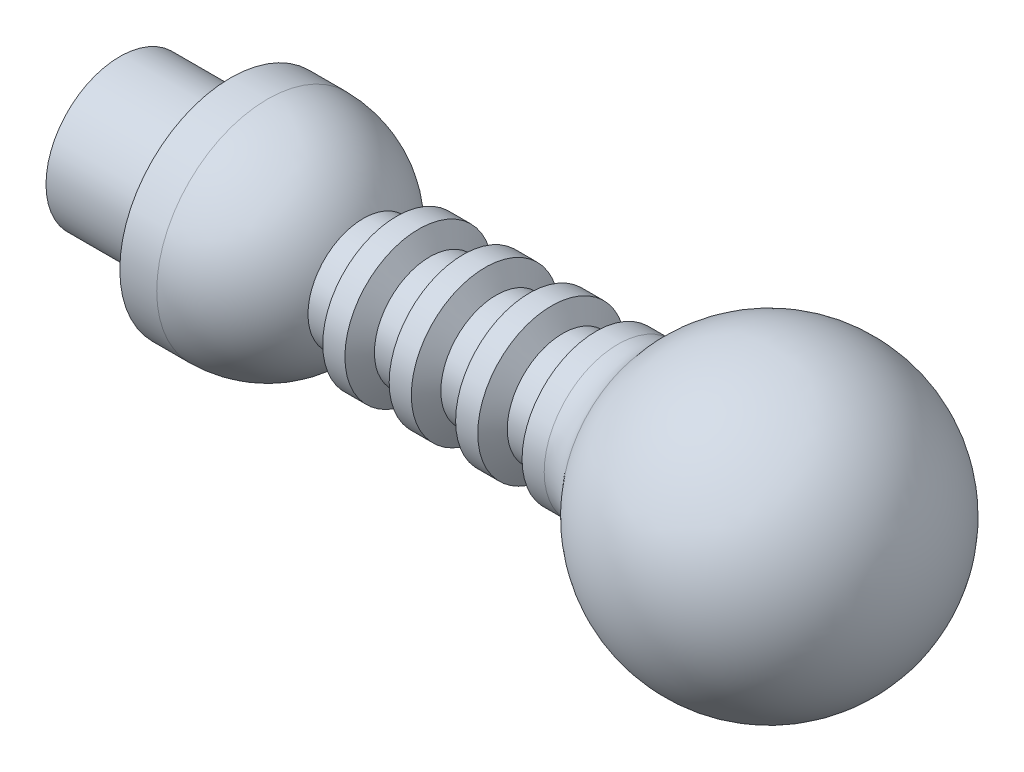
from build123d import *


with BuildPart() as part:
    # Sketch1 → Revolve1 (revolve)
    with BuildSketch(Plane.XY, mode=Mode.PRIVATE) as revolve1_sk:
        with BuildLine():
            Line((0, 0), (0, 10))
            Line((0, 10), (15, 10))
            Line((15, 10), (15, 15))
            Line((15, 15), (20, 15))
            ThreePointArc((20, 15), (27.5, 12.990381057), (32.990381057, 7.5))
            Line((32.990381057, 7.5), (35.990381057, 7.5))
            Line((35.990381057, 7.5), (37.490381057, 10))
            Line((37.490381057, 10), (40.490381057, 10))
            Line((40.490381057, 10), (41.990381057, 7.5))
            Line((41.990381057, 7.5), (44.990381057, 7.5))
            Line((44.990381057, 7.5), (46.490381057, 10))
            Line((46.490381057, 10), (49.490381057, 10))
            Line((49.490381057, 10), (50.990381057, 7.5))
            Line((50.990381057, 7.5), (53.990381057, 7.5))
            Line((53.990381057, 7.5), (55.490381057, 10))
            Line((55.490381057, 10), (58.490381057, 10))
            Line((58.490381057, 10), (59.990381057, 7.5))
            Line((59.990381057, 7.5), (62.990381057, 7.5))
            Line((62.990381057, 7.5), (64.490381057, 10))
            Line((64.490381057, 10), (67.490381057, 10))
            ThreePointArc((67.490381057, 10), (70.121555115, 10.607697794), (72.219742949, 12.307692308))
            ThreePointArc((72.219742949, 12.307692308), (94.492324045, 18.911514916), (107.984282589, 0))
            Line((107.984282589, 0), (0, 0))
        make_face()
    revolve(revolve1_sk.sketch.rotate(Axis((0, 0, 0), (1, 0, 0)), 90), axis=Axis((0, 0, 0), (1, 0, 0)))


solid = part.part
